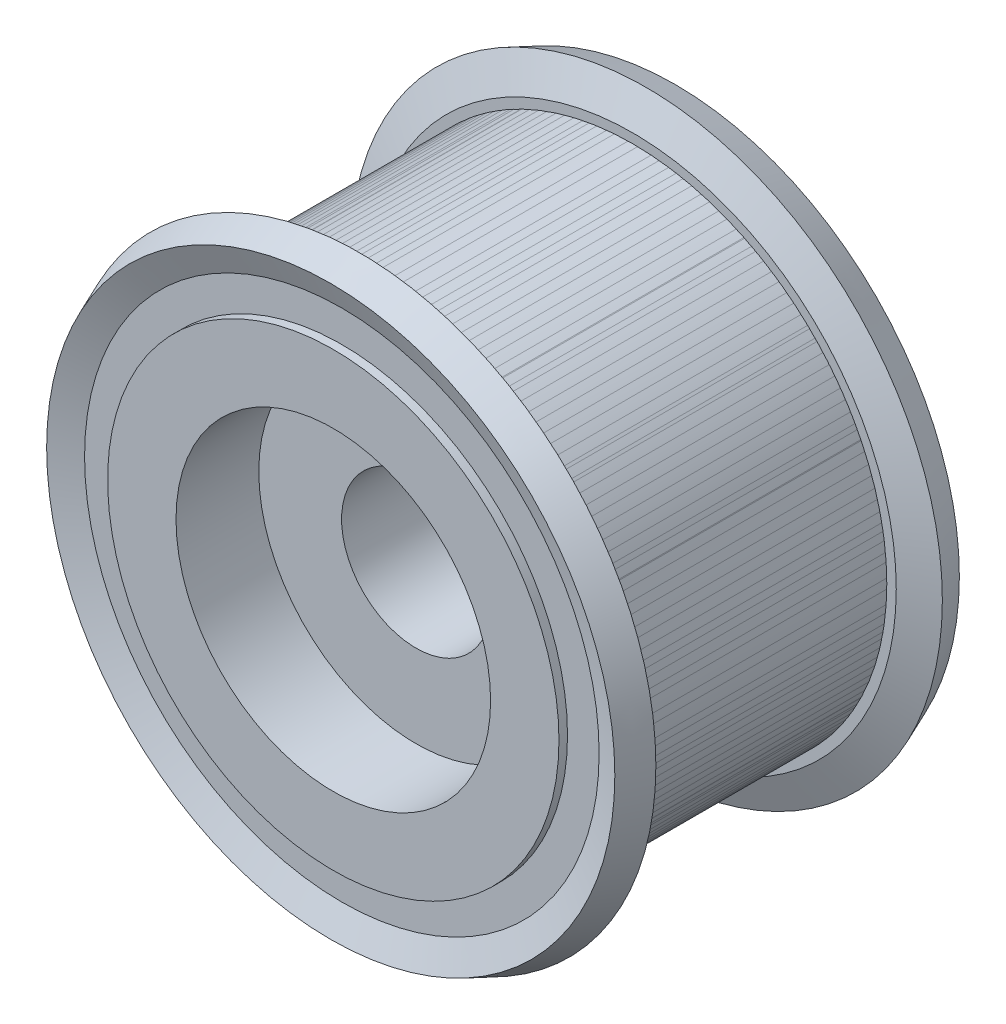
from build123d import *

# Parameters (mm, degrees)
TOOTHEXTRUDECUTGEARBELT01_DEPTH = 7.835899882
PATTERNGEARBELT01_COUNT         = 20
SKETCH_1_R                      = 9.5
CUT_EXTRUDE_1_DEPTH             = 5
SKETCH_2_R                      = 4.5
CUT_EXTRUDE_2_DEPTH             = 30.743814031


with BuildPart() as part:
    # SketchRevolveGearBelt01 → GearBelt01 (revolve)
    with BuildSketch(Plane(origin=(0, 0, 0), x_dir=(0, 0, -1), z_dir=(1, 0, 0))):
        Polygon((10.248899846, 0), (10.248899846, 13.629487395), (9.733279854, 13.629487395), (9.733279854, 15.538075019), (10.404229789, 17.157891451), (8.651279268, 17.883987331), (7.835899882, 15.915487361), (7.835899882, 15.34398737), (-7.835899882, 15.34398737), (-7.835899882, 15.915487361), (-8.651279268, 17.883987331), (-10.404229789, 17.157891451), (-9.733279854, 15.538075019), (-9.733279854, 13.629487395), (-10.248899846, 13.629487395), (-10.248899846, 0), align=None)
    revolve(axis=Axis((0, 0, 0), (0, 0, -1)))

    # SketchToothGearBelt01 → ToothExtrudeCutGearBelt01 (cut, symmetric)
    with BuildSketch(Plane.XY):
        with BuildLine():
            ThreePointArc((15.189205, 2.169993229), (15.343429185, 0), (15.189205, -2.169993229))
            add(Edge.make_bspline(
                [(15.189205, -2.169993229), (15.193305534, -2.141313845), (15.195757164, -2.097767751), (15.191587416, -2.039923228), (15.184765217, -1.996965665), (15.174297611, -1.954748066), (15.160261262, -1.913579187), (15.14275879, -1.873760103), (15.121918204, -1.835582022), (15.097891913, -1.79932415), (15.070855629, -1.76525165), (15.041007075, -1.733613699), (15.008564541, -1.704641692), (14.973765287, -1.678547436), (14.936863807, -1.655522038), (14.898129981, -1.635732867), (14.85784704, -1.619328456), (14.81630973, -1.606414559), (14.773821272, -1.597138675), (14.730694457, -1.591370625), (14.673606872, -1.58942772), (14.597833368, -1.590802706), (14.50329241, -1.587292017), (14.404301405, -1.575300386), (14.30654119, -1.555720458), (14.210619671, -1.528503959), (14.117125097, -1.493863505), (14.026633028, -1.452000056), (13.939699952, -1.403174359), (13.856860629, -1.347685871), (13.778624594, -1.285876137), (13.705473083, -1.218125284), (13.637856039, -1.144850065), (13.576189416, -1.066501192), (13.520852365, -0.98356059), (13.472185868, -0.896538423), (13.430487022, -0.805969981), (13.396020714, -0.71241229), (13.368967603, -0.616441044), (13.34961107, -0.518645741), (13.337633617, -0.419630986), (13.334152945, -0.299855766), (13.335612406, -0.160003622), (13.335055896, 0), (13.335612406, 0.160003622), (13.334152945, 0.299855766), (13.337633617, 0.419630986), (13.34961107, 0.518645741), (13.368967603, 0.616441044), (13.396020714, 0.71241229), (13.430487022, 0.805969981), (13.472185868, 0.896538423), (13.520852365, 0.98356059), (13.576189416, 1.066501192), (13.637856039, 1.144850065), (13.705473083, 1.218125284), (13.778624594, 1.285876137), (13.856860629, 1.347685871), (13.939699952, 1.403174359), (14.026633028, 1.452000056), (14.117125097, 1.493863505), (14.210619671, 1.528503959), (14.30654119, 1.555720458), (14.404301405, 1.575300386), (14.50329241, 1.587292017), (14.597833368, 1.590802706), (14.673606872, 1.58942772), (14.730694457, 1.591370625), (14.773821272, 1.597138675), (14.81630973, 1.606414559), (14.85784704, 1.619328456), (14.898129981, 1.635732867), (14.936863807, 1.655522038), (14.973765287, 1.678547436), (15.008564541, 1.704641692), (15.041007075, 1.733613699), (15.070855629, 1.76525165), (15.097891913, 1.79932415), (15.121918204, 1.835582022), (15.14275879, 1.873760103), (15.160261262, 1.913579187), (15.174297611, 1.954748066), (15.184765217, 1.996965665), (15.191587416, 2.039923228), (15.195757164, 2.097767751), (15.193305534, 2.141313845), (15.189205, 2.169993229)],
                knots=[0, 0, 0, 0, 0.013304592, 0.019956888, 0.026609185, 0.033261481, 0.039913777, 0.046566073, 0.053218369, 0.059870665, 0.066522961, 0.073175258, 0.079827554, 0.08647985, 0.093132146, 0.099784442, 0.106436738, 0.113089034, 0.11974133, 0.126393627, 0.133045923, 0.145957551, 0.161209637, 0.176461722, 0.191713808, 0.206965894, 0.222217979, 0.237470065, 0.252722151, 0.267974236, 0.283226322, 0.298478408, 0.313730493, 0.328982579, 0.344234665, 0.35948675, 0.374738836, 0.389990922, 0.405243007, 0.420495093, 0.435747179, 0.450999264, 0.475499632, 0.5, 0.524500368, 0.549000736, 0.564252821, 0.579504907, 0.594756993, 0.610009078, 0.625261164, 0.64051325, 0.655765335, 0.671017421, 0.686269507, 0.701521592, 0.716773678, 0.732025764, 0.747277849, 0.762529935, 0.777782021, 0.793034106, 0.808286192, 0.823538278, 0.838790363, 0.854042449, 0.866954077, 0.873606373, 0.88025867, 0.886910966, 0.893563262, 0.900215558, 0.906867854, 0.91352015, 0.920172446, 0.926824742, 0.933477039, 0.940129335, 0.946781631, 0.953433927, 0.960086223, 0.966738519, 0.973390815, 0.980043112, 0.986695408, 1, 1, 1, 1], degree=3))
        make_face()
    toothextrudecutgearbelt01 = extrude(amount=TOOTHEXTRUDECUTGEARBELT01_DEPTH, both=True, mode=Mode.SUBTRACT)

    # PatternGearBelt01: ToothExtrudeCutGearBelt01 ×20 about axis
    patterngearbelt01_axis = Axis((0, 0, 55), (0, 0, -1))
    for i in range(1, PATTERNGEARBELT01_COUNT):
        add(toothextrudecutgearbelt01.rotate(patterngearbelt01_axis, i * 360 / PATTERNGEARBELT01_COUNT), mode=Mode.SUBTRACT)

    # 草图1 → 切除-拉伸1 (cut)
    with BuildSketch(Plane.XY.offset(10.248899846)):
        Circle(SKETCH_1_R)
    cut_extrude_1 = extrude(amount=-CUT_EXTRUDE_1_DEPTH, mode=Mode.SUBTRACT)

    # 镜向1: 切除-拉伸1 across plane
    add(cut_extrude_1.mirror(Plane.XY), mode=Mode.SUBTRACT)

    # 草图2 → 切除-拉伸2 (cut, through all)
    with BuildSketch(Plane.XY.offset(5.248899846)):
        Circle(SKETCH_2_R)
    extrude(amount=-CUT_EXTRUDE_2_DEPTH, mode=Mode.SUBTRACT)


solid = part.part
